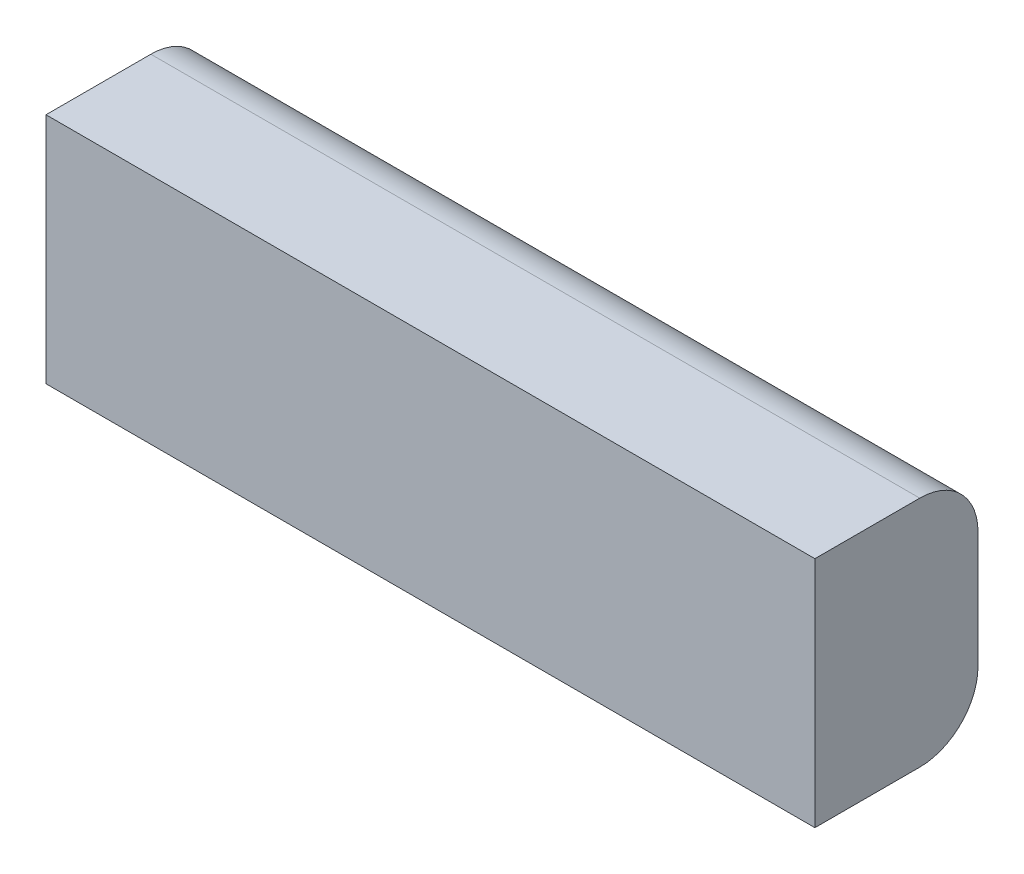
from build123d import *

# Parameters (mm, degrees)
BOSS_EXTRUDE1_DEPTH = 419.1
BOSS_EXTRUDE2_DEPTH = 0.0254


with BuildPart() as part:
    # Sketch1 → Boss-Extrude1 (new body)
    with BuildSketch(Plane(origin=(0, 0, 0), x_dir=(0, 0, -1), z_dir=(1, 0, 0))):
        with BuildLine():
            Line((0, 0), (57.15, 0))
            ThreePointArc((57.15, 0), (79.600640303, 9.299359697), (88.9, 31.75))
            Line((88.9, 31.75), (88.9, 95.25))
            ThreePointArc((88.9, 95.25), (79.600640303, 117.700640303), (57.15, 127))
            Line((57.15, 127), (0, 127))
            Line((0, 127), (0, 0))
        make_face()
    extrude(amount=BOSS_EXTRUDE1_DEPTH)

    # Sketch2 → Boss-Extrude2 (add)
    # profile 1 of 4: a face of its own
    with BuildSketch(Plane(origin=(0, 0, -88.9), x_dir=(-1, 0, 0), z_dir=(0, 0, -1))):
        Polygon((-259.290402428, 87.225987453), (-258.364360761, 87.225987453), (-258.364360761, 52.056756684), (-252.5028223, 52.056756684), (-252.5028223, 46.846500274), (-258.364360761, 46.846500274), (-258.364360761, 35.123423351), (-262.92333512, 35.123423351), (-262.92333512, 46.846500274), (-287.020771018, 46.846500274), align=None)
        Polygon((-262.92333512, 52.056756684), (-262.92333512, 74.118936171), (-278.065642812, 52.056756684), align=None, mode=Mode.SUBTRACT)
    # profile 2 of 4: a face of its own
    with BuildSketch(Plane(origin=(0, 0, -88.9), x_dir=(-1, 0, 0), z_dir=(0, 0, -1))):
        Polygon((-237.146812684, 85.923423351), (-227.754104351, 85.923423351), (-227.754104351, 35.123423351), (-232.31307871, 35.123423351), (-232.31307871, 80.71316694), (-240.128463325, 80.71316694), align=None)
    # profile 3 of 4: a face of its own
    with BuildSketch(Plane(origin=(0, 0, -88.9), x_dir=(-1, 0, 0), z_dir=(0, 0, -1))):
        Polygon((-181.136556274, 87.225987453), (-180.210514607, 87.225987453), (-180.210514607, 52.056756684), (-174.348976146, 52.056756684), (-174.348976146, 46.846500274), (-180.210514607, 46.846500274), (-180.210514607, 35.123423351), (-184.769488966, 35.123423351), (-184.769488966, 46.846500274), (-208.866924864, 46.846500274), align=None)
        Polygon((-184.769488966, 52.056756684), (-184.769488966, 74.118936171), (-199.911796659, 52.056756684), align=None, mode=Mode.SUBTRACT)
    # profile 4 of 4: a face of its own
    with BuildSketch(Plane(origin=(0, 0, -88.9), x_dir=(-1, 0, 0), z_dir=(0, 0, -1))):
        with BuildLine():
            Line((-146.343847941, 87.225987453), (-142.833030633, 84.468215017))
            Line((-142.833030633, 84.468215017), (-156.255546659, 63.94265412))
            add(Edge.make_bspline(
                [(-156.255546659, 63.94265412), (-155.361898067, 64.085095297), (-153.618735447, 64.362942919), (-151.854293263, 64.408778242), (-150.994408838, 64.431115658)],
                knots=[0, 0, 0, 0, 1.025318673, 2, 2, 2, 2], degree=3))
            add(Edge.make_bspline(
                [(-150.994408838, 64.431115658), (-150.478099463, 64.41723838), (-149.461759822, 64.38992137), (-147.969592522, 64.179698623), (-146.53574168, 63.848408427), (-145.166150279, 63.365485398), (-143.855902428, 62.748594083), (-142.597479079, 62.009252766), (-141.414535618, 61.109284606), (-140.291838502, 60.103953247), (-139.272542346, 58.990461015), (-138.370101311, 57.808978757), (-137.612066734, 56.560737398), (-136.997039528, 55.246369173), (-136.519448719, 53.867900148), (-136.171285185, 52.427094009), (-135.965478524, 50.922957224), (-135.937531401, 49.900016851), (-135.92333512, 49.380394504)],
                knots=[0, 0, 0, 0, 1.04369286, 2.054478336, 3.041073146, 4.015093852, 4.984733326, 5.965804835, 6.960378782, 7.985147595, 9.009457201, 10.008161701, 10.986880575, 11.956520048, 12.937015923, 13.931873656, 14.949455224, 16, 16, 16, 16], degree=3))
            add(Edge.make_bspline(
                [(-135.92333512, 49.380394504), (-135.943990471, 48.669489087), (-135.984635313, 47.270595467), (-136.389638981, 45.233127843), (-137.018973254, 43.292095903), (-137.918532809, 41.478489873), (-139.03587711, 39.794795434), (-140.398443313, 38.302937822), (-141.9579088, 36.972412709), (-143.7212029, 35.859796636), (-145.618843636, 34.951158067), (-147.61240977, 34.298519696), (-149.682540922, 33.896713912), (-151.087590662, 33.846340593), (-151.79833512, 33.820859248)],
                knots=[0, 0, 0, 0, 1.031375318, 2.029502543, 3.004789286, 3.987476834, 4.960371455, 5.9300674, 6.912260825, 7.929083631, 8.949397511, 9.960523116, 10.96833055, 12, 12, 12, 12], degree=3))
            add(Edge.make_bspline(
                [(-151.79833512, 33.820859248), (-152.48191009, 33.843040063), (-153.83595242, 33.886976373), (-155.827788404, 34.2783677), (-157.741685913, 34.912745078), (-159.564235785, 35.78671232), (-161.252546395, 36.890638164), (-162.762984775, 38.219599244), (-164.088019675, 39.745188052), (-165.19073703, 41.467167949), (-166.065349482, 43.317593618), (-166.721248967, 45.247081488), (-167.104371583, 47.248601223), (-167.157908351, 48.605413186), (-167.184873582, 49.288807966)],
                knots=[0, 0, 0, 0, 1.012016664, 2.004627821, 2.994792927, 3.992885782, 4.990978636, 5.973936114, 6.964471063, 7.975201453, 8.993600317, 9.990122807, 10.98767138, 12, 12, 12, 12], degree=3))
            add(Edge.make_bspline(
                [(-167.184873582, 49.288807966), (-167.167725751, 49.811969345), (-167.132713158, 50.880164923), (-166.888243378, 52.497985671), (-166.495417214, 54.153355657), (-166.055485638, 55.557673667), (-165.590656784, 56.708098043), (-165.203814209, 57.635611564), (-164.722317353, 58.59008657), (-164.208897991, 59.604252486), (-163.617341151, 60.651972481), (-162.974131154, 61.750757169), (-162.261484792, 62.883131662), (-161.761900716, 63.651578839), (-161.506508197, 64.04441694)],
                knots=[0, 0, 0, 0, 1.173818275, 2.396712641, 3.66331629, 4.989737886, 5.693666774, 6.447286557, 7.243889047, 8.091586357, 8.998013824, 9.943181721, 10.948533338, 12, 12, 12, 12], degree=3))
            Line((-161.506508197, 64.04441694), (-146.343847941, 87.225987453))
        make_face()
        with BuildLine():
            add(Edge.make_bspline(
                [(-151.950979351, 59.220859248), (-152.33796279, 59.2095665), (-153.093853864, 59.187508482), (-154.202852912, 59.059416254), (-155.252428104, 58.818202388), (-156.256484787, 58.510988198), (-157.196251446, 58.088578074), (-158.078558036, 57.575471964), (-158.906816503, 56.971370292), (-159.672351483, 56.284831354), (-160.366419739, 55.533165047), (-160.964134437, 54.728064553), (-161.479716702, 53.888932691), (-161.898915673, 53.008758216), (-162.225343058, 52.087877593), (-162.461465099, 51.130526202), (-162.592873831, 50.130284273), (-162.614735706, 49.451995376), (-162.625899223, 49.105634889)],
                knots=[0, 0, 0, 0, 1.129588631, 2.206414736, 3.251139165, 4.268635594, 5.265702196, 6.250456724, 7.242448911, 8.251968645, 9.246821453, 10.222880186, 11.173611482, 12.116736599, 13.062300278, 14.020270554, 14.989073742, 16, 16, 16, 16], degree=3))
            add(Edge.make_bspline(
                [(-162.625899223, 49.105634889), (-162.616808033, 48.762372324), (-162.598981564, 48.089285536), (-162.437113607, 47.097391158), (-162.189861555, 46.142860487), (-161.822063809, 45.230614425), (-161.383342118, 44.346747866), (-160.804144842, 43.523275723), (-160.162369779, 42.71018442), (-159.395232687, 41.969934491), (-158.57193359, 41.281135489), (-157.692350423, 40.679079238), (-156.77562872, 40.164022778), (-155.809392079, 39.760364562), (-154.807349249, 39.429086341), (-153.761151493, 39.195965442), (-152.67007119, 39.064168093), (-151.930975632, 39.04227774), (-151.554104351, 39.031115658)],
                knots=[0, 0, 0, 0, 0.989467248, 1.94019797, 2.891935182, 3.827694429, 4.772920941, 5.730924762, 6.725747692, 7.756678648, 8.79901574, 9.819492441, 10.826891316, 11.826466727, 12.835195252, 13.867842842, 14.912794438, 16, 16, 16, 16], degree=3))
            add(Edge.make_bspline(
                [(-151.554104351, 39.031115658), (-151.177233687, 39.042278616), (-150.43813934, 39.064170685), (-149.34705026, 39.195955593), (-148.30088495, 39.429122483), (-147.298724196, 39.760233548), (-146.332922854, 40.164508796), (-145.417002896, 40.675874945), (-144.545737995, 41.284838026), (-143.721898436, 41.968757384), (-142.957954417, 42.714397635), (-142.300787055, 43.516017606), (-141.739327555, 44.353403287), (-141.283082783, 45.22713266), (-140.919336041, 46.143412081), (-140.670830174, 47.097243388), (-140.509296495, 48.089324222), (-140.491424093, 48.76238539), (-140.482309479, 49.105634889)],
                knots=[0, 0, 0, 0, 1.087397944, 2.132534446, 3.165364764, 4.174271784, 5.174024072, 6.181601208, 7.194203697, 8.236725232, 9.267838612, 10.269026844, 11.221737037, 12.171628256, 13.107553087, 14.05945871, 15.010357665, 16, 16, 16, 16], degree=3))
            add(Edge.make_bspline(
                [(-140.482309479, 49.105634889), (-140.490296589, 49.452447228), (-140.505972688, 50.13312706), (-140.683278456, 51.130078776), (-140.929184911, 52.092741769), (-141.300504328, 53.01506583), (-141.782909034, 53.893411288), (-142.370496771, 54.732215095), (-143.050238077, 55.537908136), (-143.835425223, 56.286305469), (-144.690174904, 56.970611629), (-145.598995401, 57.574689762), (-146.549796847, 58.084503709), (-147.541615212, 58.509875365), (-148.585814766, 58.816844875), (-149.665537403, 59.058554803), (-150.794592696, 59.18718066), (-151.560607469, 59.209490063), (-151.950979351, 59.220859248)],
                knots=[0, 0, 0, 0, 0.978206639, 1.919901502, 2.851605144, 3.780102724, 4.718870031, 5.675451981, 6.667674623, 7.690630536, 8.733308323, 9.756129687, 10.767539656, 11.776269907, 12.797430371, 13.836405707, 14.897401972, 16, 16, 16, 16], degree=3))
        make_face(mode=Mode.SUBTRACT)
    extrude(amount=BOSS_EXTRUDE2_DEPTH)


solid = part.part
